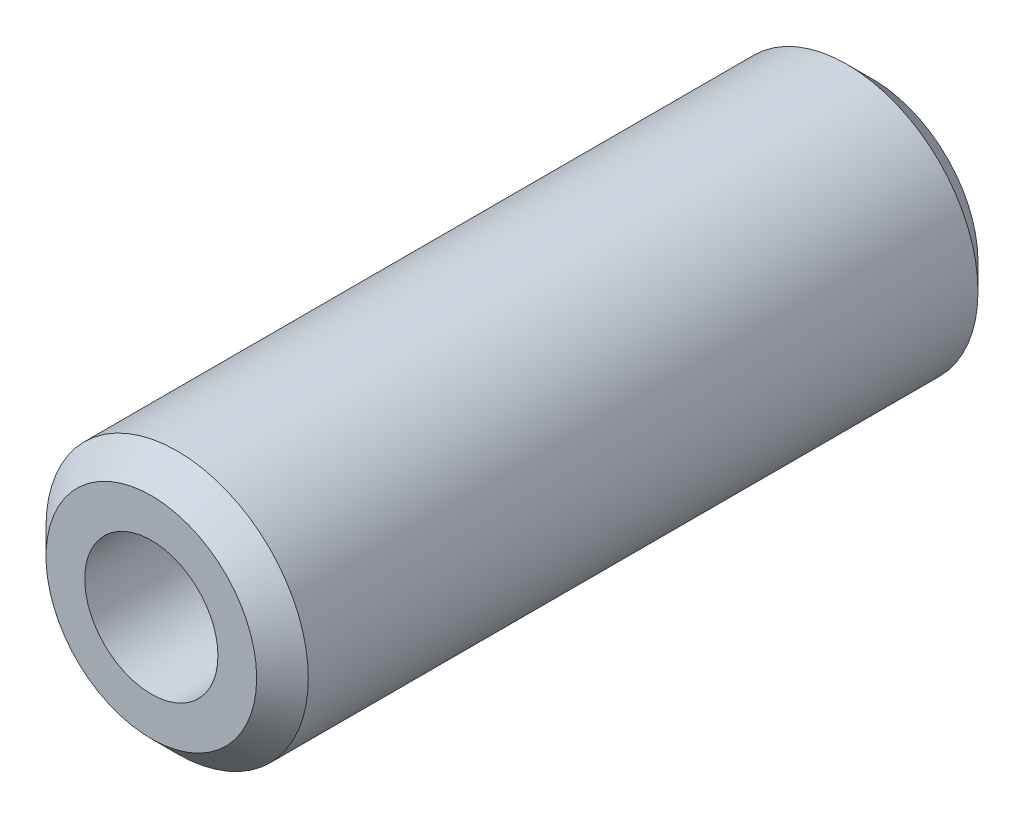
from build123d import *

# Parameters (mm, degrees)
SKETCH1_R           = 12.7
BOSS_EXTRUDE1_DEPTH = 34.925
SKETCH2_R           = 6.45
CUT_EXTRUDE1_DEPTH  = 73.122135992
CHAMFER1_SIZE       = 2.5


with BuildPart() as part:
    # Sketch1 → Boss-Extrude1 (new, symmetric)
    with BuildSketch(Plane.XY):
        Circle(SKETCH1_R)
    extrude(amount=BOSS_EXTRUDE1_DEPTH, both=True)

    # Sketch2 → Cut-Extrude1 (cut, through all)
    with BuildSketch(Plane.XY.offset(34.925)):
        Circle(SKETCH2_R)
    extrude(amount=-CUT_EXTRUDE1_DEPTH, mode=Mode.SUBTRACT)

    # Chamfer1
    chamfer1_edges = [part.edges().sort_by_distance(p)[0] for p in [
        (-12.7, 0, -34.925),
        (-12.7, 0, 34.925),
    ]]
    chamfer(chamfer1_edges, length=CHAMFER1_SIZE)


solid = part.part
